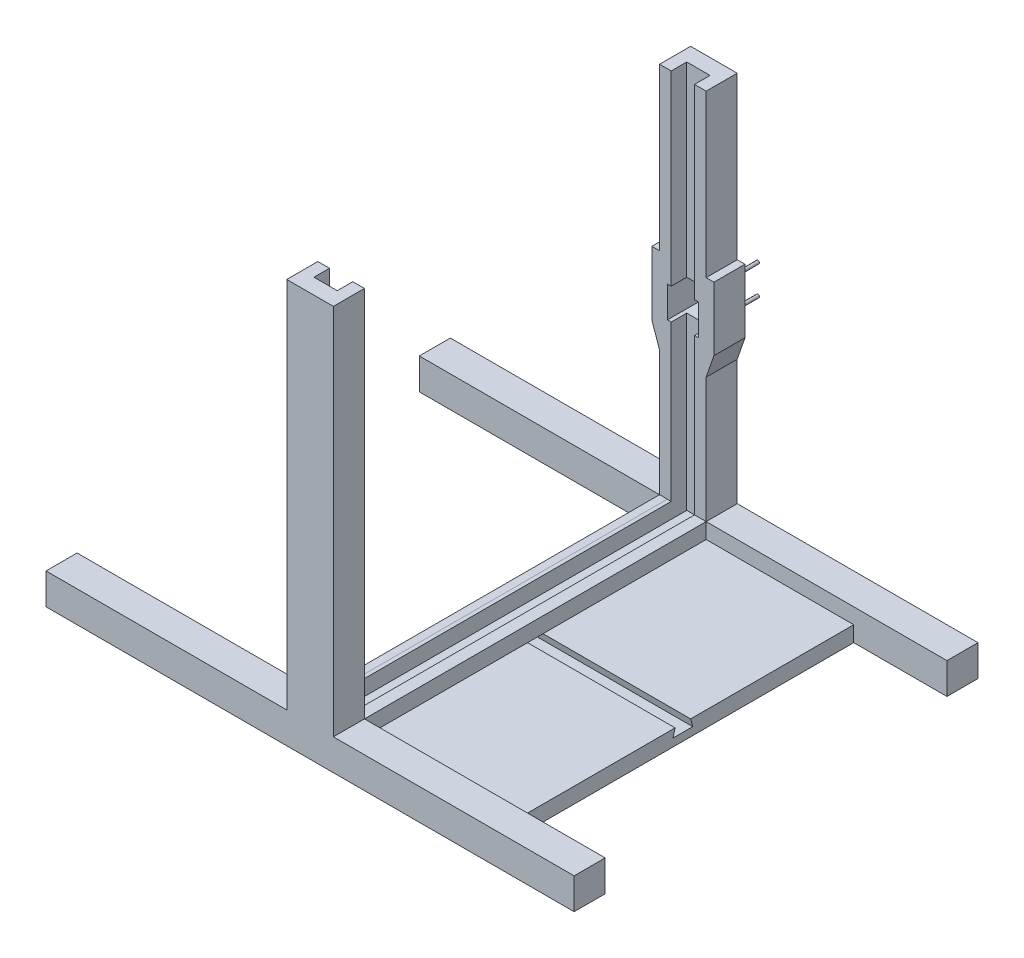
from build123d import *

# Parameters (mm, degrees)
BOSS_EXTRUDE2_DEPTH  = 6.35
BOSS_EXTRUDE3_DEPTH  = 6.35
SKETCH3_W            = 1.5875
SKETCH3_H            = 158.75
BOSS_EXTRUDE4_DEPTH  = 6.35
SKETCH4_W            = 12.7
SKETCH4_H            = 6.35
BOSS_EXTRUDE5_DEPTH  = 158.75
SKETCH5_W            = 12.7
SKETCH5_H            = 6.35
BOSS_EXTRUDE6_DEPTH  = 158.75
SKETCH6_W            = 1.5875
SKETCH6_H            = 158.75
BOSS_EXTRUDE7_DEPTH  = 6.35
SKETCH7_W            = 1.5875
SKETCH7_H            = 158.75
BOSS_EXTRUDE8_DEPTH  = 6.35
SKETCH8_W            = 1.5875
SKETCH8_H            = 6.35
BOSS_EXTRUDE9_DEPTH  = 139.7
SKETCH10_W           = 1.5875
SKETCH10_H           = 6.35
BOSS_EXTRUDE10_DEPTH = 139.7
SKETCH11_W           = 12.7
SKETCH11_H           = 12.699759929
BOSS_EXTRUDE11_DEPTH = 101.6
SKETCH12_W           = 101.404934815
SKETCH12_H           = 12.7
BOSS_EXTRUDE12_DEPTH = 6.35
SKETCH13_W           = 101.6
SKETCH13_H           = 12.7
BOSS_EXTRUDE13_DEPTH = 6.35
SKETCH14_W           = 12.7
SKETCH14_H           = 12.7
BOSS_EXTRUDE14_DEPTH = 101.6
SKETCH15_W           = 139.7
SKETCH15_H           = 6.35
BOSS_EXTRUDE15_DEPTH = 63.5
CUT_EXTRUDE1_DEPTH   = 3.175
CUT_EXTRUDE1_DRAFT   = 15
CUT_EXTRUDE3_DEPTH   = 6.35
SKETCH18_W           = 12.7
SKETCH18_H           = 152.4
BOSS_EXTRUDE17_DEPTH = 3.175
SKETCH19_W           = 12.7
SKETCH19_H           = 152.4
BOSS_EXTRUDE18_DEPTH = 3.175
SKETCH20_W           = 12.7
SKETCH20_H           = 152.4
BOSS_EXTRUDE19_DEPTH = 3.175
SKETCH21_W           = 12.7
SKETCH21_H           = 152.4
BOSS_EXTRUDE20_DEPTH = 3.175
SKETCH22_W           = 139.7
SKETCH22_H           = 6.35
BOSS_EXTRUDE21_DEPTH = 3.175
SKETCH23_W           = 139.7
SKETCH23_H           = 12.699759929
BOSS_EXTRUDE22_DEPTH = 3.175
CUT_EXTRUDE4_DEPTH   = 12.7
SKETCH30_W           = 12.7
SKETCH30_H           = 26.035
BOSS_EXTRUDE25_DEPTH = 3.175
SKETCH31_W           = 12.7
SKETCH31_H           = 26.035
BOSS_EXTRUDE26_DEPTH = 3.175
BOSS_EXTRUDE27_DEPTH = 12.7
BOSS_EXTRUDE28_DEPTH = 12.7
SKETCH37_R           = 0.635
BOSS_EXTRUDE29_DEPTH = 7.9375


with BuildPart() as part:
    # Sketch1 → Boss-Extrude2 (new body)
    with BuildSketch(Plane.XY):
        Polygon((0, 0), (215.704934815, 0), (215.704934815, 12.7), (114.104934815, 12.7), (114.104934815, 165.1), (101.404934815, 165.1), (101.404934815, 12.7), (0, 12.7), align=None)
    extrude(amount=BOSS_EXTRUDE2_DEPTH)

    # Sketch2 → Boss-Extrude3 (add)
    with BuildSketch(Plane.XY.offset(6.35)):
        Polygon((101.404934815, 12.7), (101.404934815, 6.35), (102.992434815, 6.35), (102.992434815, 165.1), (101.404934815, 165.1), align=None)
    extrude(amount=BOSS_EXTRUDE3_DEPTH)

    # Sketch3 → Boss-Extrude4 (add)
    with BuildSketch(Plane.XY.offset(6.35)):
        with Locations((113.311184815, 85.725)):
            Rectangle(SKETCH3_W, SKETCH3_H)
    extrude(amount=BOSS_EXTRUDE4_DEPTH)

    # Sketch4 → Boss-Extrude5 (add)
    with BuildSketch(Plane.XY.offset(6.35)):
        with Locations((107.754934815, 3.175)):
            Rectangle(SKETCH4_W, SKETCH4_H)
    extrude(amount=BOSS_EXTRUDE5_DEPTH)

    # Sketch5 → Boss-Extrude6 (add)
    with BuildSketch(Plane(origin=(0, 6.35, 0), x_dir=(1, 0, 0), z_dir=(0, 1, 0))):
        with Locations((107.754934815, -161.925)):
            Rectangle(SKETCH5_W, SKETCH5_H)
    extrude(amount=BOSS_EXTRUDE6_DEPTH)

    # Sketch6 → Boss-Extrude7 (add)
    with BuildSketch(Plane(origin=(0, 0, 158.75), x_dir=(-1, 0, 0), z_dir=(0, 0, -1))):
        with Locations((-102.198684815, 85.725)):
            Rectangle(SKETCH6_W, SKETCH6_H)
    extrude(amount=BOSS_EXTRUDE7_DEPTH)

    # Sketch7 → Boss-Extrude8 (add)
    with BuildSketch(Plane(origin=(0, 0, 158.75), x_dir=(-1, 0, 0), z_dir=(0, 0, -1))):
        with Locations((-113.311184815, 85.725)):
            Rectangle(SKETCH7_W, SKETCH7_H)
    extrude(amount=BOSS_EXTRUDE8_DEPTH)

    # Sketch8 → Boss-Extrude9 (add)
    with BuildSketch(Plane(origin=(0, 0, 152.4), x_dir=(-1, 0, 0), z_dir=(0, 0, -1))):
        with Locations((-113.311184815, 9.525)):
            Rectangle(SKETCH8_W, SKETCH8_H)
    extrude(amount=BOSS_EXTRUDE9_DEPTH)

    # Sketch10 → Boss-Extrude10 (add)
    with BuildSketch(Plane.XY.offset(12.7)):
        with Locations((102.198684815, 9.525)):
            Rectangle(SKETCH10_W, SKETCH10_H)
    extrude(amount=BOSS_EXTRUDE10_DEPTH)

    # Sketch11 → Boss-Extrude11 (add)
    with BuildSketch(Plane.ZY.offset(-101.404934815)):
        with Locations((158.75, 6.349879965)):
            Rectangle(SKETCH11_W, SKETCH11_H)
    extrude(amount=BOSS_EXTRUDE11_DEPTH)

    # Sketch12 → Boss-Extrude12 (add)
    with BuildSketch(Plane.XY.offset(6.35)):
        with Locations((50.702467408, 6.35)):
            Rectangle(SKETCH12_W, SKETCH12_H)
    extrude(amount=BOSS_EXTRUDE12_DEPTH)

    # Sketch13 → Boss-Extrude13 (add)
    with BuildSketch(Plane.XY.offset(6.35)):
        with Locations((164.904934815, 6.35)):
            Rectangle(SKETCH13_W, SKETCH13_H)
    extrude(amount=BOSS_EXTRUDE13_DEPTH)

    # Sketch14 → Boss-Extrude14 (add)
    with BuildSketch(Plane(origin=(114.104934815, 0, 0), x_dir=(0, 0, -1), z_dir=(1, 0, 0))):
        with Locations((-158.75, 6.35)):
            Rectangle(SKETCH14_W, SKETCH14_H)
    extrude(amount=BOSS_EXTRUDE14_DEPTH)

    # Sketch15 → Boss-Extrude15 (add)
    with BuildSketch(Plane(origin=(114.104934815, 0, 0), x_dir=(0, 0, -1), z_dir=(1, 0, 0))):
        with Locations((-82.55, 3.175)):
            Rectangle(SKETCH15_W, SKETCH15_H)
    extrude(amount=BOSS_EXTRUDE15_DEPTH)


with BuildPart() as cut_extrude1_tool:
    # Sketch16 → Cut-Extrude1 (with draft: the straight prism first)
    with BuildSketch(Plane(origin=(0, 6.35, 0), x_dir=(1, 0, 0), z_dir=(0, 1, 0))):
        Polygon((177.604934815, -82.55), (177.604934815, -79.375), (114.104934815, -79.375), (114.104934815, -82.55), (114.104934815, -85.725), (177.604934815, -85.725), align=None)
    extrude(amount=-CUT_EXTRUDE1_DEPTH)
    # Cut-Extrude1: the draft: its side faces are tilted about the plane it starts from
    cut_extrude1_sides = [cut_extrude1_tool.faces().sort_by_distance(p)[0] for p in [
        (177.604934815, 4.7625, 82.55),
        (114.104934815, 4.7625, 82.55),
        (145.854934815, 4.7625, 85.725),
        (145.854934815, 4.7625, 79.375),
    ]]
    draft(cut_extrude1_sides, Plane(origin=(0, 6.35, 0), x_dir=(1, 0, 0), z_dir=(0, 1, 0)), CUT_EXTRUDE1_DRAFT)


with BuildPart() as part_1:
    add(part.part)

    # Cut-Extrude1: cut by cut_extrude1_tool
    add(cut_extrude1_tool.part, mode=Mode.SUBTRACT)

    # Sketch17 → Cut-Extrude3 (cut)
    with BuildSketch(Plane(origin=(0, 0, 0), x_dir=(-1, 0, 0), z_dir=(0, 0, -1))):
        Polygon((-107.803701111, 87.3125), (-112.566201111, 87.3125), (-112.566201111, 82.55), (-112.566201111, 77.784684897), (-107.806516214, 77.784684897), (-103.041201111, 77.784684897), (-103.041201111, 82.55), (-103.041201111, 87.3125), align=None)
    extrude(amount=-CUT_EXTRUDE3_DEPTH, mode=Mode.SUBTRACT)

    # Sketch18 → Boss-Extrude17 (add)
    with BuildSketch(Plane.ZY.offset(-101.404934815)):
        with Locations((6.35, 88.9)):
            Rectangle(SKETCH18_W, SKETCH18_H)
    extrude(amount=BOSS_EXTRUDE17_DEPTH)

    # Sketch19 → Boss-Extrude18 (add)
    with BuildSketch(Plane(origin=(114.104934815, 0, 0), x_dir=(0, 0, -1), z_dir=(1, 0, 0))):
        with Locations((-6.35, 88.9)):
            Rectangle(SKETCH19_W, SKETCH19_H)
    extrude(amount=BOSS_EXTRUDE18_DEPTH)

    # Sketch20 → Boss-Extrude19 (add)
    with BuildSketch(Plane.ZY.offset(-101.404934815)):
        with Locations((158.75, 88.9)):
            Rectangle(SKETCH20_W, SKETCH20_H)
    extrude(amount=BOSS_EXTRUDE19_DEPTH)

    # Sketch21 → Boss-Extrude20 (add)
    with BuildSketch(Plane(origin=(114.104934815, 0, 0), x_dir=(0, 0, -1), z_dir=(1, 0, 0))):
        with Locations((-158.75, 88.9)):
            Rectangle(SKETCH21_W, SKETCH21_H)
    extrude(amount=BOSS_EXTRUDE20_DEPTH)

    # Sketch22 → Boss-Extrude21 (add)
    with BuildSketch(Plane(origin=(114.104934815, 0, 0), x_dir=(0, 0, -1), z_dir=(1, 0, 0))):
        with Locations((-82.55, 9.525)):
            Rectangle(SKETCH22_W, SKETCH22_H)
    extrude(amount=BOSS_EXTRUDE21_DEPTH)

    # Sketch23 → Boss-Extrude22 (add)
    with BuildSketch(Plane.ZY.offset(-101.404934815)):
        with Locations((82.55, 6.349879965)):
            Rectangle(SKETCH23_W, SKETCH23_H)
    extrude(amount=BOSS_EXTRUDE22_DEPTH)

    # Sketch25 → Cut-Extrude4 (cut)
    with BuildSketch(Plane(origin=(0, 0, 0), x_dir=(-1, 0, 0), z_dir=(0, 0, -1))):
        Polygon((-112.566201111, 88.9), (-101.453701111, 88.9), (-101.453701111, 76.2), (-114.153701111, 76.2), (-114.153701111, 88.9), align=None)
    extrude(amount=-CUT_EXTRUDE4_DEPTH, mode=Mode.SUBTRACT)

    # Sketch30 → Boss-Extrude25 (add)
    with BuildSketch(Plane(origin=(117.279934815, 0, 0), x_dir=(0, 0, -1), z_dir=(1, 0, 0))):
        with Locations((-6.35, 86.0425)):
            Rectangle(SKETCH30_W, SKETCH30_H)
    extrude(amount=BOSS_EXTRUDE25_DEPTH)

    # Sketch31 → Boss-Extrude26 (add)
    with BuildSketch(Plane.ZY.offset(-98.229934815)):
        with Locations((6.35, 86.0425)):
            Rectangle(SKETCH31_W, SKETCH31_H)
    extrude(amount=BOSS_EXTRUDE26_DEPTH)

    # Sketch32 → Boss-Extrude27 (add)
    with BuildSketch(Plane(origin=(0, 0, 0), x_dir=(-1, 0, 0), z_dir=(0, 0, -1))):
        Polygon((-120.454934815, 73.025), (-117.279934815, 63.840058945), (-117.279934815, 73.025), align=None)
    extrude(amount=-BOSS_EXTRUDE27_DEPTH)

    # Sketch36 → Boss-Extrude28 (add)
    with BuildSketch(Plane(origin=(0, 0, 0), x_dir=(-1, 0, 0), z_dir=(0, 0, -1))):
        Polygon((-95.054934815, 73.025), (-98.229934815, 63.911198594), (-98.229934815, 73.025), align=None)
    extrude(amount=-BOSS_EXTRUDE28_DEPTH)

    # Sketch37 → Boss-Extrude29 (add)
    with BuildSketch(Plane(origin=(0, 0, 0), x_dir=(-1, 0, 0), z_dir=(0, 0, -1))):
        with Locations((-117.803681111, 82.55)):
            Circle(SKETCH37_R)
        with Locations((-96.803672311, 82.55)):
            Circle(SKETCH37_R)
        with Locations((-96.803672311, 94.5500014)):
            Circle(SKETCH37_R)
        with Locations((-117.803681111, 94.5500014)):
            Circle(SKETCH37_R)
    extrude(amount=BOSS_EXTRUDE29_DEPTH)


solid = part_1.part
